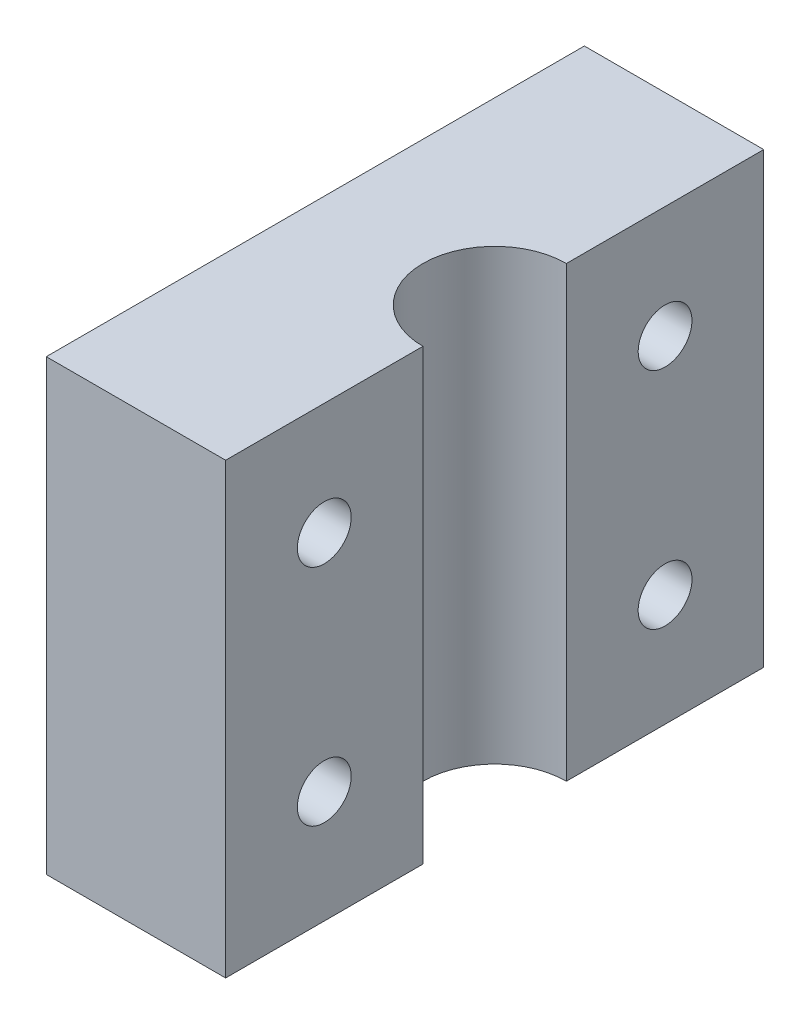
from build123d import *

# Parameters (mm, degrees)
SKETCH_1_W          = 30
SKETCH_1_H          = 25
EXTRUDE_1_DEPTH     = 10
SKETCH_2_R          = 4
CUT_EXTRUDE_1_DEPTH = 41.311288741
SKETCH_3_R          = 1.5
CUT_EXTRUDE_2_DEPTH = 41.311288741


with BuildPart() as part:
    # 스케치1 → 보스-돌출1 (new body)
    with BuildSketch(Plane(origin=(0, 0, 0), x_dir=(0, 0, -1), z_dir=(1, 0, 0))):
        with Locations((15, 12.5)):
            Rectangle(SKETCH_1_W, SKETCH_1_H)
    extrude(amount=EXTRUDE_1_DEPTH)

    # 스케치2 → 컷-돌출1 (cut, through all)
    with BuildSketch(Plane(origin=(0, 25, 0), x_dir=(1, 0, 0), z_dir=(0, 1, 0))):
        with Locations((10, 15)):
            Circle(SKETCH_2_R)
    extrude(amount=-CUT_EXTRUDE_1_DEPTH, mode=Mode.SUBTRACT)

    # 스케치3 → 컷-돌출2 (cut, through all)
    with BuildSketch(Plane(origin=(10, 0, 0), x_dir=(0, 0, -1), z_dir=(1, 0, 0))):
        with Locations((5.5, 18.75)):
            Circle(SKETCH_3_R)
        with Locations(Location((24.5, 18.75, 0), (0, 0, 180))):
            Circle(SKETCH_3_R)
        with Locations(Location((5.5, 6.25, 0), (0, 0, 180))):
            Circle(SKETCH_3_R)
        with Locations((24.5, 6.25)):
            Circle(SKETCH_3_R)
    extrude(amount=-CUT_EXTRUDE_2_DEPTH, mode=Mode.SUBTRACT)


solid = part.part
